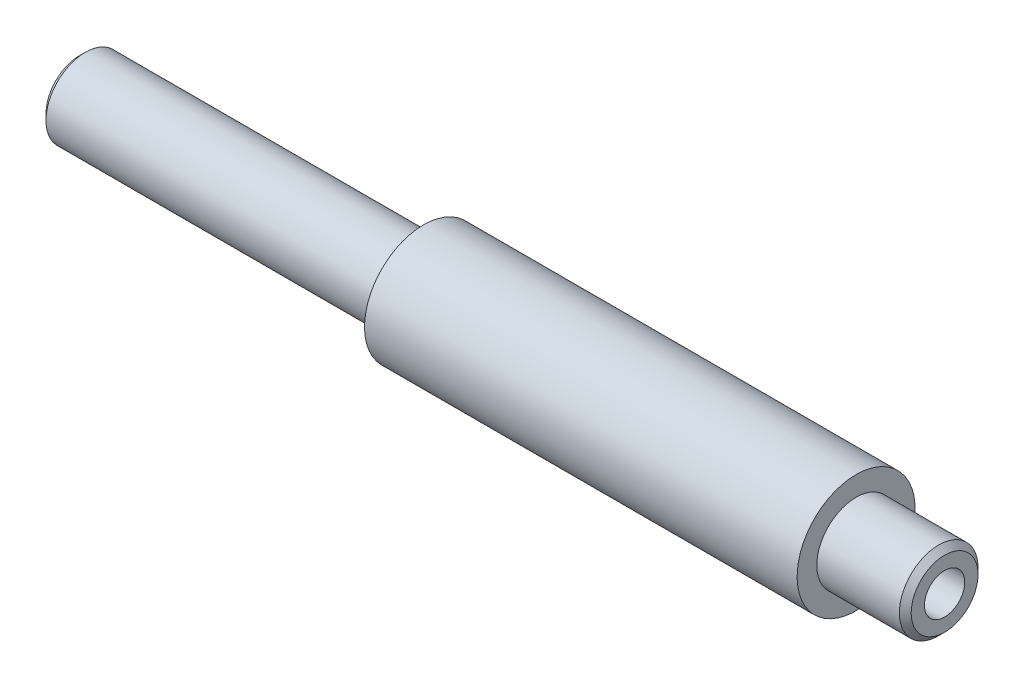
from build123d import *

# Parameters (mm, degrees)
TROU_TARAUD_M2_51_D     = 2.05
TROU_TARAUD_M2_51_DEPTH = 8
TROU_TARAUD_M2_51_TIP   = 0.615882135
TROU_TARAUD_M2_52_D     = 2.05
TROU_TARAUD_M2_52_DEPTH = 8
TROU_TARAUD_M2_52_TIP   = 0.615882135
CHANFREIN1_SIZE         = 0.3


with BuildPart() as part:
    # Esquisse1 → Révolution1 (revolve)
    with BuildSketch(Plane.XY):
        Polygon((0, 0), (0, 2), (17.5, 2), (17.5, 3), (39.5, 3), (39.5, 2), (44, 2), (44, 0), align=None)
    revolve(axis=Axis((44, 0, 0), (-1, 0, 0)))

    # Trou taraudé M2.51
    with Locations(Plane.ZY):
        with Locations((0, 0)):
            Hole(TROU_TARAUD_M2_51_D / 2, depth=TROU_TARAUD_M2_51_DEPTH)
            with Locations((0, 0, -(TROU_TARAUD_M2_51_DEPTH + TROU_TARAUD_M2_51_TIP / 2))):  # 118° drill point
                Cone(0, TROU_TARAUD_M2_51_D / 2, TROU_TARAUD_M2_51_TIP, mode=Mode.SUBTRACT)

    # Trou taraudé M2.52
    with Locations(Plane(origin=(44, 0, 0), x_dir=(0, 0, -1), z_dir=(1, 0, 0))):
        with Locations((0, 0)):
            Hole(TROU_TARAUD_M2_52_D / 2, depth=TROU_TARAUD_M2_52_DEPTH)
            with Locations((0, 0, -(TROU_TARAUD_M2_52_DEPTH + TROU_TARAUD_M2_52_TIP / 2))):  # 118° drill point
                Cone(0, TROU_TARAUD_M2_52_D / 2, TROU_TARAUD_M2_52_TIP, mode=Mode.SUBTRACT)

    # Chanfrein1
    chanfrein1_edges = [part.edges().sort_by_distance(p)[0] for p in [
        (44, -2, 0),
        (0, -2, 0),
    ]]
    chamfer(chanfrein1_edges, length=CHANFREIN1_SIZE)


solid = part.part
